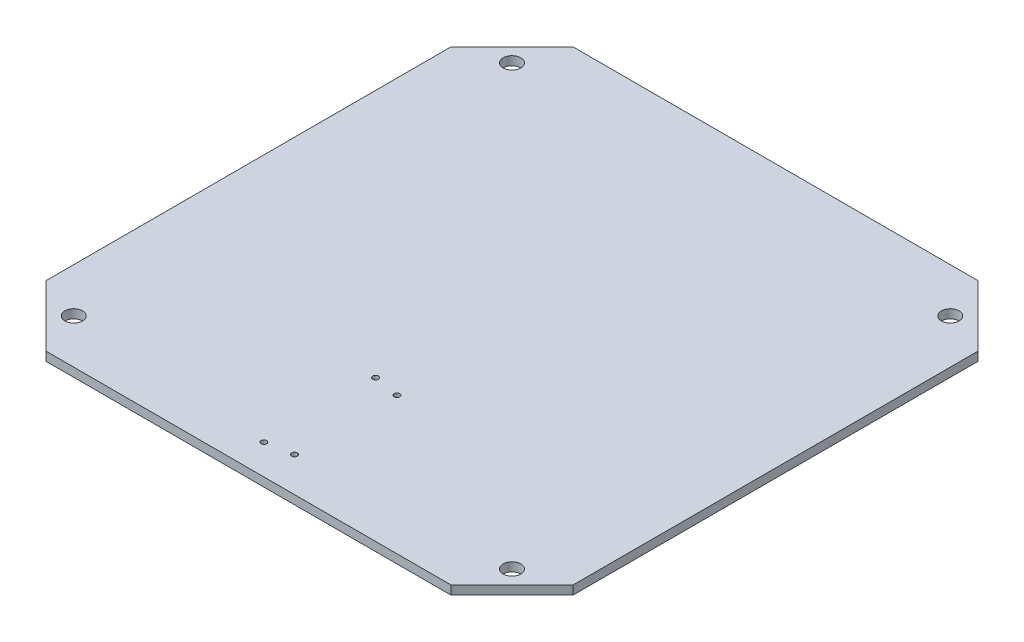
from build123d import *

# Parameters (mm, degrees)
BOSS_EXTRUDE1_DEPTH = 1.59
SKETCH2_R           = 1.59
SKETCH2_R_2         = 0.51
CUT_EXTRUDE2_DEPTH  = 68.193958806


with BuildPart() as part:
    # Sketch1 → Boss-Extrude1 (new body)
    with BuildSketch(Plane(origin=(0, 0, 0), x_dir=(1, 0, 0), z_dir=(0, 1, 0))):
        Polygon((-47.5, 36.5), (-36.5, 47.5), (36.5, 47.5), (47.5, 36.5), (47.5, -36.5), (36.5, -47.5), (-36.5, -47.5), (-47.5, -36.5), align=None)
    extrude(amount=BOSS_EXTRUDE1_DEPTH)

    # Sketch2 → Cut-Extrude2 (cut, through all)
    with BuildSketch(Plane(origin=(0, 1.59, 0), x_dir=(1, 0, 0), z_dir=(0, 1, 0))):
        with Locations(Location((-39.5, 39.5, 0), (0, 0, 270))):
            Circle(SKETCH2_R)
        with Locations(Location((-39.5, -39.5, 0), (0, 0, 270))):
            Circle(SKETCH2_R)
        with Locations(Location((39.5, -39.5, 0), (0, 0, 270))):
            Circle(SKETCH2_R)
        with Locations(Location((39.5, 39.5, 0), (0, 0, 270))):
            Circle(SKETCH2_R)
        with Locations(Location((-2.67, -21.93, 0), (0, 0, 270))):
            Circle(SKETCH2_R_2)
        with Locations(Location((2.03, -22.75, 0), (0, 0, 270))):
            Circle(SKETCH2_R_2)
        with Locations(Location((-2.67, -42.07, 0), (0, 0, 270))):
            Circle(SKETCH2_R_2)
        with Locations(Location((2.03, -41.24, 0), (0, 0, 270))):
            Circle(SKETCH2_R_2)
    extrude(amount=-CUT_EXTRUDE2_DEPTH, mode=Mode.SUBTRACT)


solid = part.part
